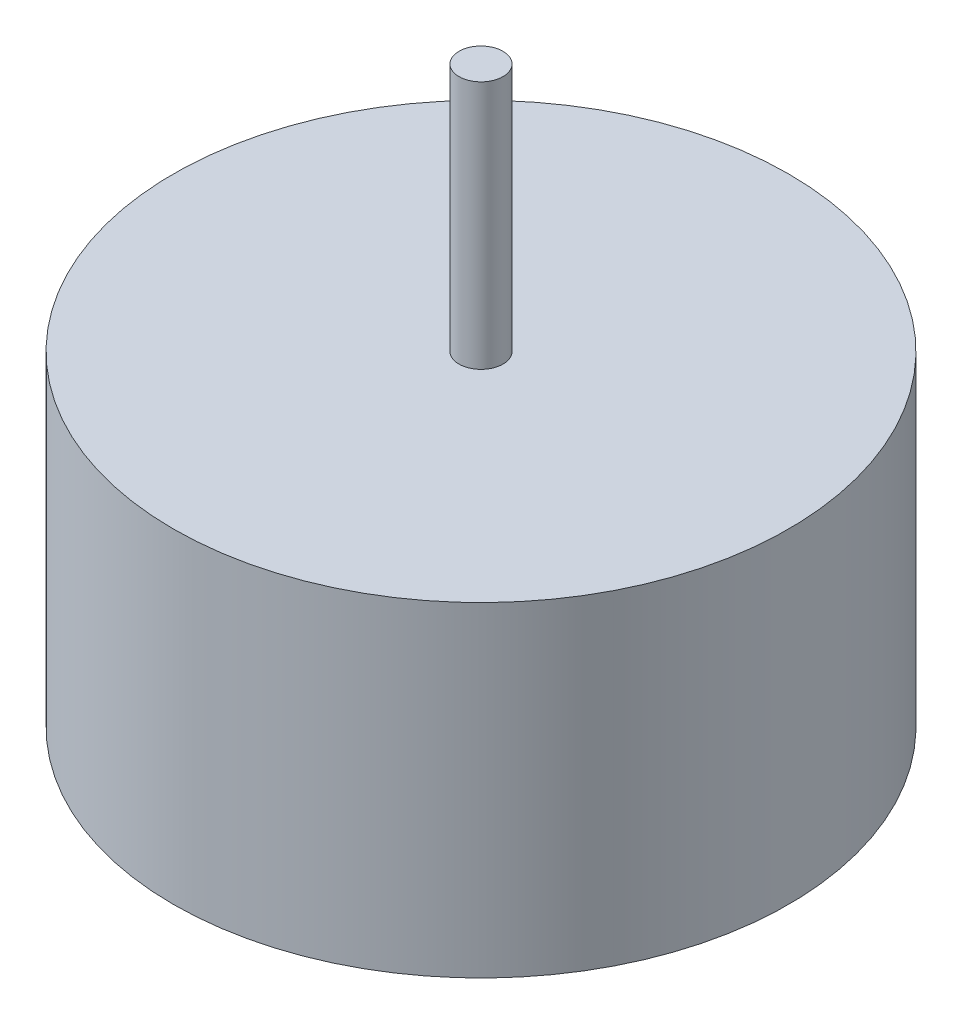
from build123d import *

# Parameters (mm, degrees)
SKETCH1_R           = 21
BOSS_EXTRUDE1_DEPTH = 22.2
SKETCH2_R           = 1.5
BOSS_EXTRUDE2_DEPTH = 39.2


with BuildPart() as part:
    # Sketch1 → Boss-Extrude1 (new body)
    with BuildSketch(Plane(origin=(0, 0, 0), x_dir=(1, 0, 0), z_dir=(0, 1, 0))):
        with Locations(Location((0, 0, 0), (0, 0, 270))):
            Circle(SKETCH1_R)
    extrude(amount=BOSS_EXTRUDE1_DEPTH)

    # Sketch2 → Boss-Extrude2 (add)
    with BuildSketch(Plane(origin=(0, 0, 0), x_dir=(1, 0, 0), z_dir=(0, 1, 0))):
        with Locations(Location((0, 0, 0), (0, 0, 270))):
            Circle(SKETCH2_R)
    extrude(amount=BOSS_EXTRUDE2_DEPTH)


solid = part.part
